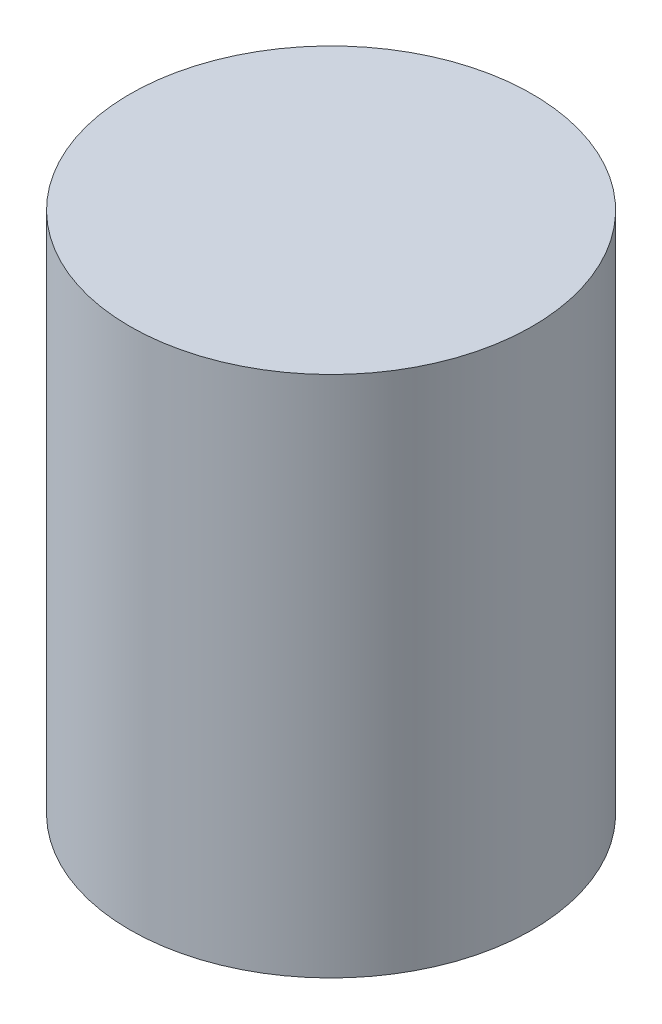
from build123d import *

# Parameters (mm, degrees)
SKETCH1_R           = 3.85
BOSS_EXTRUDE1_DEPTH = 10


with BuildPart() as part:
    # Sketch1 → Boss-Extrude1 (new body)
    with BuildSketch(Plane(origin=(0, 0, 0), x_dir=(1, 0, 0), z_dir=(0, 1, 0))):
        with Locations(Location((0, 0, 0), (0, 0, 270))):
            Circle(SKETCH1_R)
    extrude(amount=BOSS_EXTRUDE1_DEPTH)


solid = part.part
